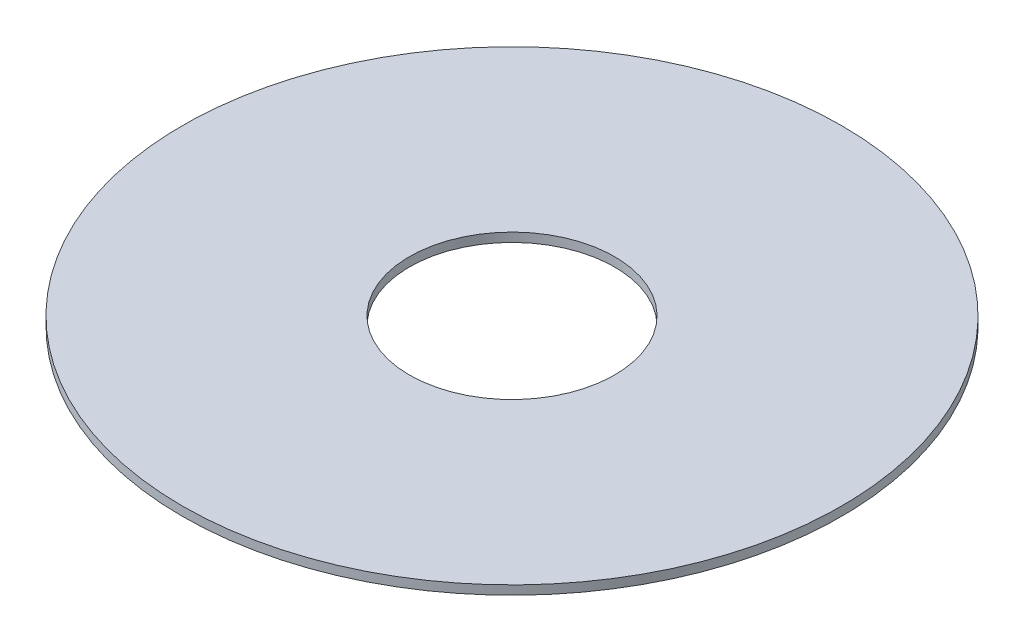
from build123d import *

# Parameters (mm, degrees)
SKETCH1_R           = 12.85
SKETCH1_R_2         = 4
BOSS_EXTRUDE1_DEPTH = 0.35


with BuildPart() as part:
    # Sketch1 → Boss-Extrude1 (new body)
    with BuildSketch(Plane(origin=(0, 0, 0), x_dir=(1, 0, 0), z_dir=(0, 1, 0))):
        with Locations(Location((0, 0, 0), (0, 0, 270))):
            Circle(SKETCH1_R)
        with Locations(Location((0, 0, 0), (0, 0, 270))):
            Circle(SKETCH1_R_2, mode=Mode.SUBTRACT)
    extrude(amount=BOSS_EXTRUDE1_DEPTH)


solid = part.part
